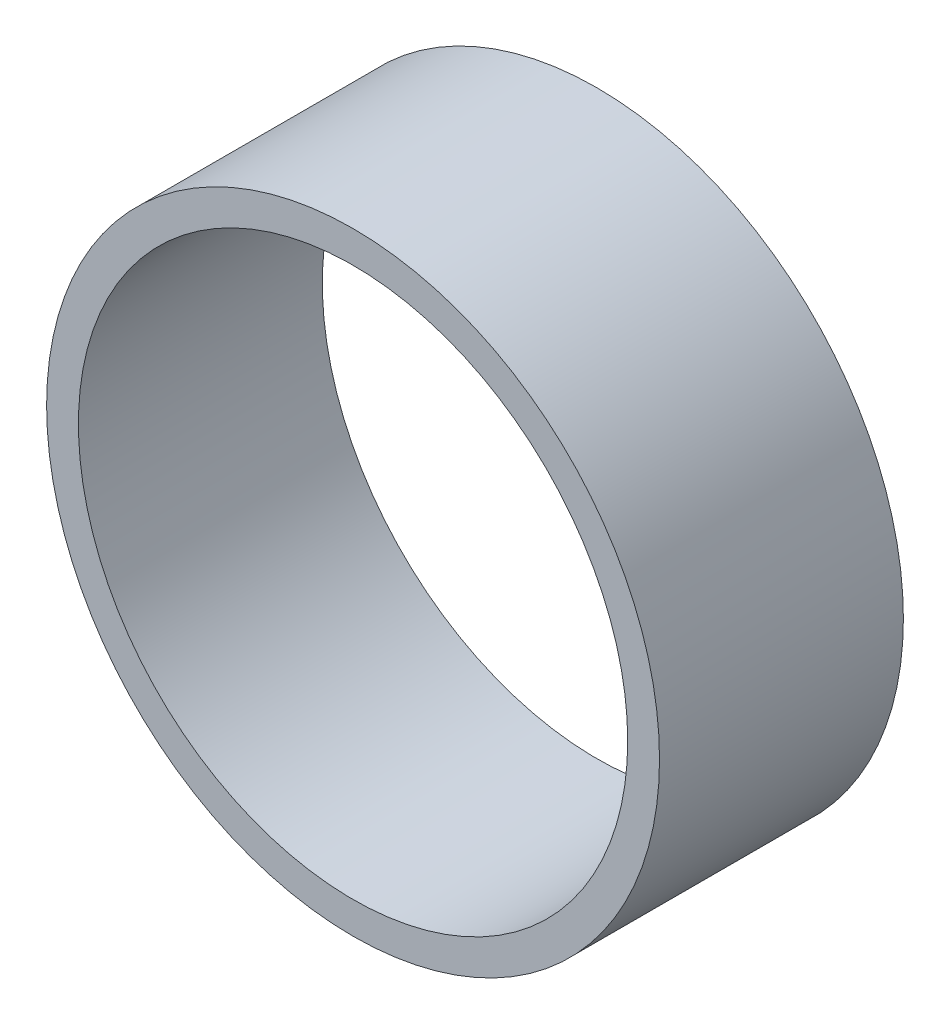
from build123d import *

# Parameters (mm, degrees)
SKETCH1_R           = 15.08
SKETCH1_R_2         = 13.515
BOSS_EXTRUDE1_DEPTH = 12


with BuildPart() as part:
    # Sketch1 → Boss-Extrude1 (new body)
    with BuildSketch(Plane.XY):
        Circle(SKETCH1_R)
        Circle(SKETCH1_R_2, mode=Mode.SUBTRACT)
    extrude(amount=BOSS_EXTRUDE1_DEPTH)


solid = part.part
